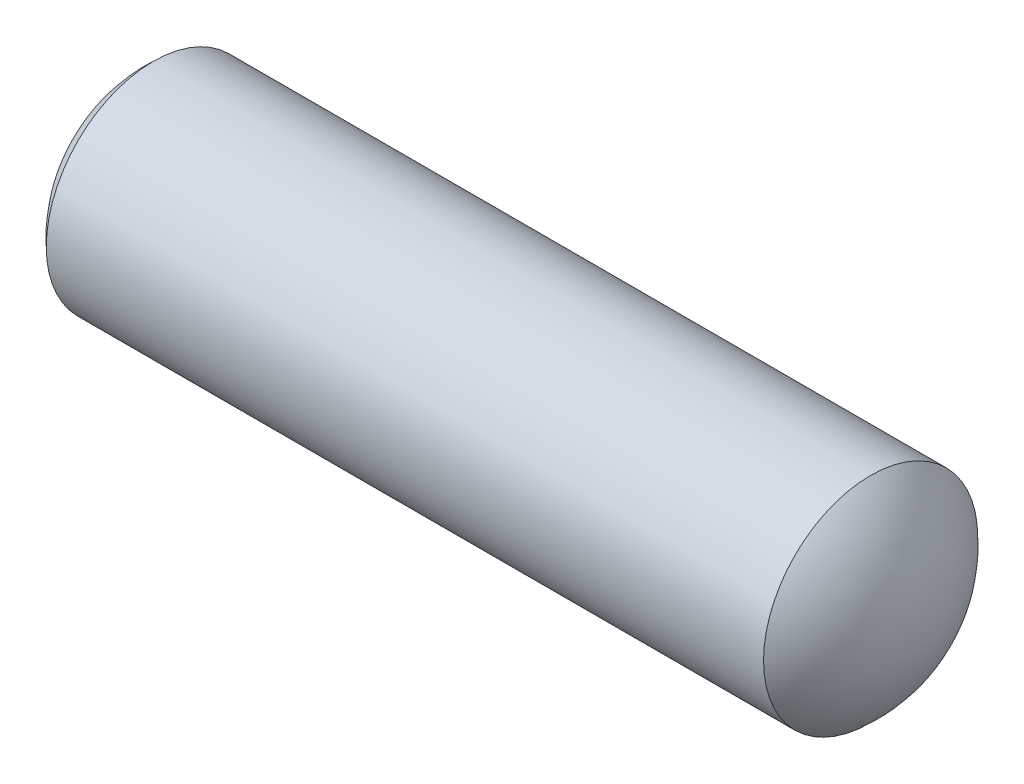
from build123d import *


with BuildPart() as part:
    # Esquisse2 → Révolution1 (revolve)
    with BuildSketch(Plane.XY):
        with BuildLine():
            Line((-11.4, 0), (11.4, 0))
            ThreePointArc((11.4, 0), (11.045751311, 1.645751311), (10.045751311, 3))
            Line((10.045751311, 3), (-10.045751311, 3))
            ThreePointArc((-10.045751311, 3), (-11.045751311, 1.645751311), (-11.4, 0))
        make_face()
    revolve(axis=Axis((-27.28976, 0, 0), (1, 0, 0)))


solid = part.part
